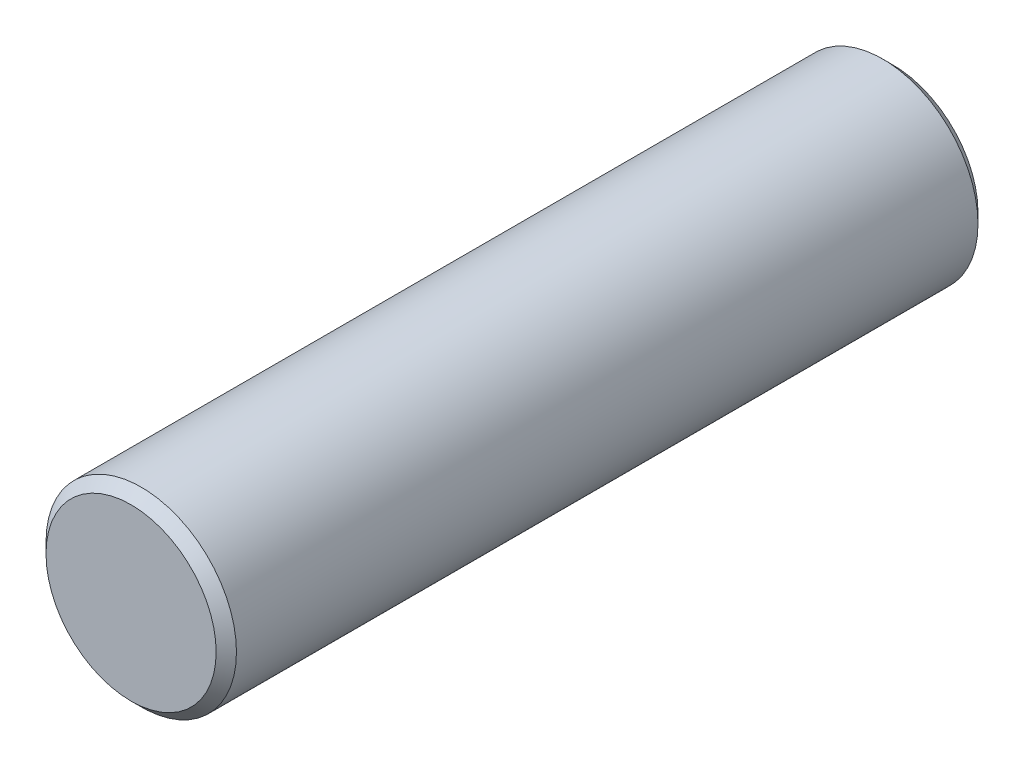
from build123d import *

# Parameters (mm, degrees)
SKETCH1_R           = 4.7625
BOSS_EXTRUDE1_DEPTH = 38.1
CHAMFER1_SIZE       = 0.508


with BuildPart() as part:
    # Sketch1 → Boss-Extrude1 (new body)
    with BuildSketch(Plane.XY):
        with Locations(Location((0, 0, 0), (0, 0, 180))):
            Circle(SKETCH1_R)
    extrude(amount=BOSS_EXTRUDE1_DEPTH)

    # Chamfer1
    chamfer1_edges = [part.edges().sort_by_distance(p)[0] for p in [
        (4.7625, 0, 0),
        (4.7625, 0, 38.1),
    ]]
    chamfer(chamfer1_edges, length=CHAMFER1_SIZE)


solid = part.part
